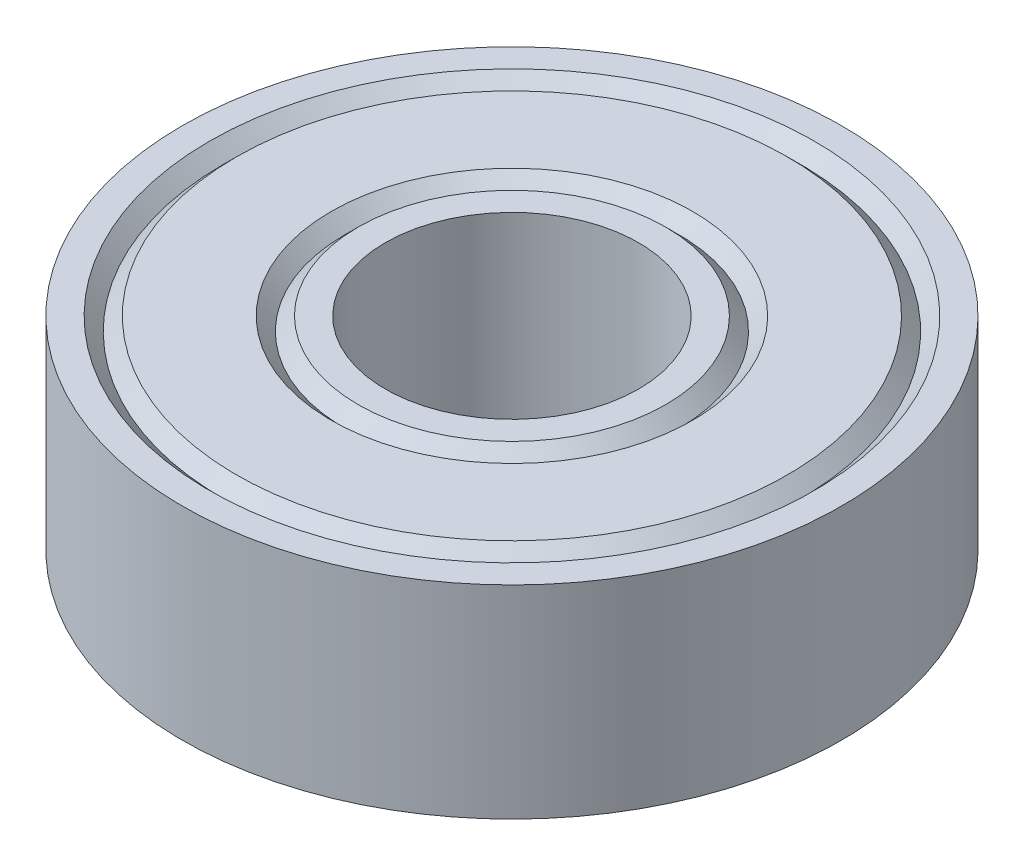
from build123d import *


with BuildPart() as part:
    # Sketch1 → Revolve1 (revolve)
    with BuildSketch(Plane.XY):
        Polygon((-2.5, 2), (-3.033333333, 2), (-3.3, 1.733333333), (-3.566666667, 2), (-5.433333333, 2), (-5.7, 1.733333333), (-5.966666667, 2), (-6.5, 2), (-6.5, -2), (-5.966666667, -2), (-5.7, -1.733333333), (-5.433333333, -2), (-3.566666667, -2), (-3.3, -1.733333333), (-3.033333333, -2), (-2.5, -2), align=None)
    revolve(axis=Axis((0, 2, 0), (0, -1, 0)))


solid = part.part
